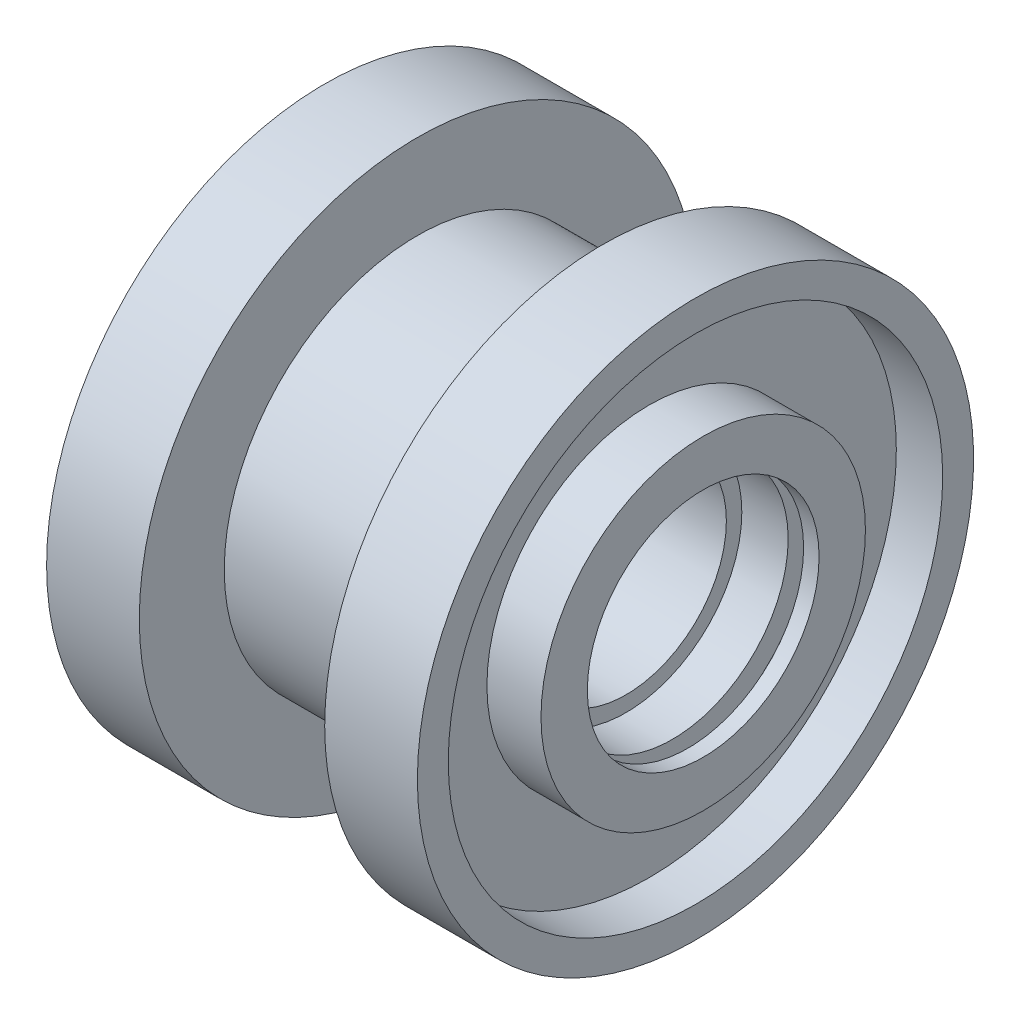
from build123d import *

# Parameters (mm, degrees)
SZKIC2_R                   = 0.5
WYTNIJ_WYCI_GNI_CIE1_DEPTH = 1


with BuildPart() as part:
    # Szkic1 → Obrót1 (revolve)
    with BuildSketch(Plane.XY, mode=Mode.PRIVATE) as obr_t1_sk:
        Polygon((-6, 12.5), (6, 12.5), (6, 18), (12, 18), (12, 16), (9, 16), (9, 10.5), (12.5, 10.5), (12.5, 7.5), (11.5, 7.5), (11.5, 8.9), (10.5, 8.9), (10.5, 7.5), (7.5, 7.5), (7.5, 6.5), (-7.5, 6.5), (-7.5, 7.5), (-10.5, 7.5), (-10.5, 8.9), (-11.5, 8.9), (-11.5, 7.5), (-12.5, 7.5), (-12.5, 10.5), (-9, 10.5), (-9, 16), (-12, 16), (-12, 18), (-6, 18), align=None)
    revolve(obr_t1_sk.sketch.rotate(Axis((-12.5, 0, 0), (1, 0, 0)), 90), axis=Axis((-12.5, 0, 0), (1, 0, 0)))

    # Szkic2 → Wytnij-wyciągnięcie1 (cut)
    with BuildSketch(Plane.ZY.offset(12)):
        with Locations((0, 17)):
            Circle(SZKIC2_R)
    extrude(amount=-WYTNIJ_WYCI_GNI_CIE1_DEPTH, mode=Mode.SUBTRACT)


solid = part.part
